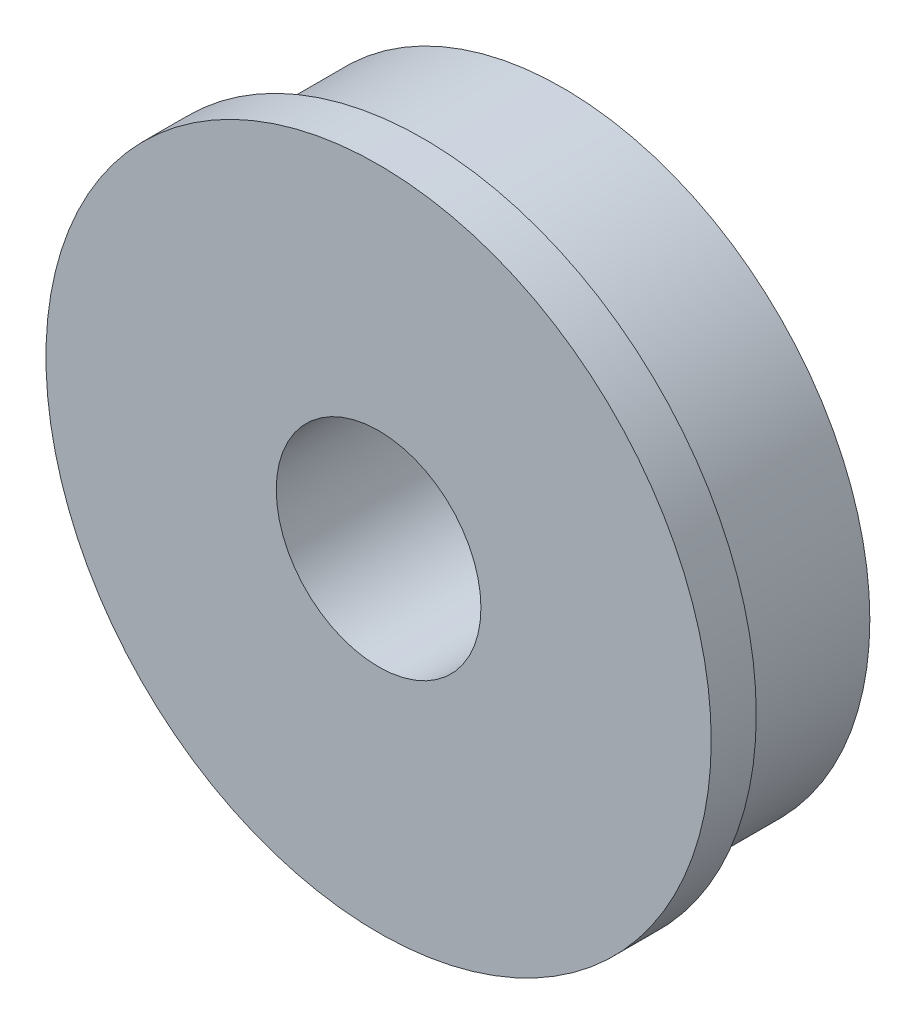
from build123d import *

# Parameters (mm, degrees)
SKETCH_1_R      = 15
SKETCH_1_R_2    = 5
EXTRUDE_1_DEPTH = 6.8
SKETCH_2_R      = 16.25
SKETCH_2_R_2    = 5
EXTRUDE_2_DEPTH = 2.2


with BuildPart() as part:
    # 草图1 → 凸台-拉伸1 (new body)
    with BuildSketch(Plane.XY):
        Circle(SKETCH_1_R)
        Circle(SKETCH_1_R_2, mode=Mode.SUBTRACT)
    extrude(amount=EXTRUDE_1_DEPTH)

    # 草图2 → 凸台-拉伸2 (add)
    with BuildSketch(Plane.XY.offset(6.8)):
        Circle(SKETCH_2_R)
        Circle(SKETCH_2_R_2, mode=Mode.SUBTRACT)
    extrude(amount=EXTRUDE_2_DEPTH)


solid = part.part
